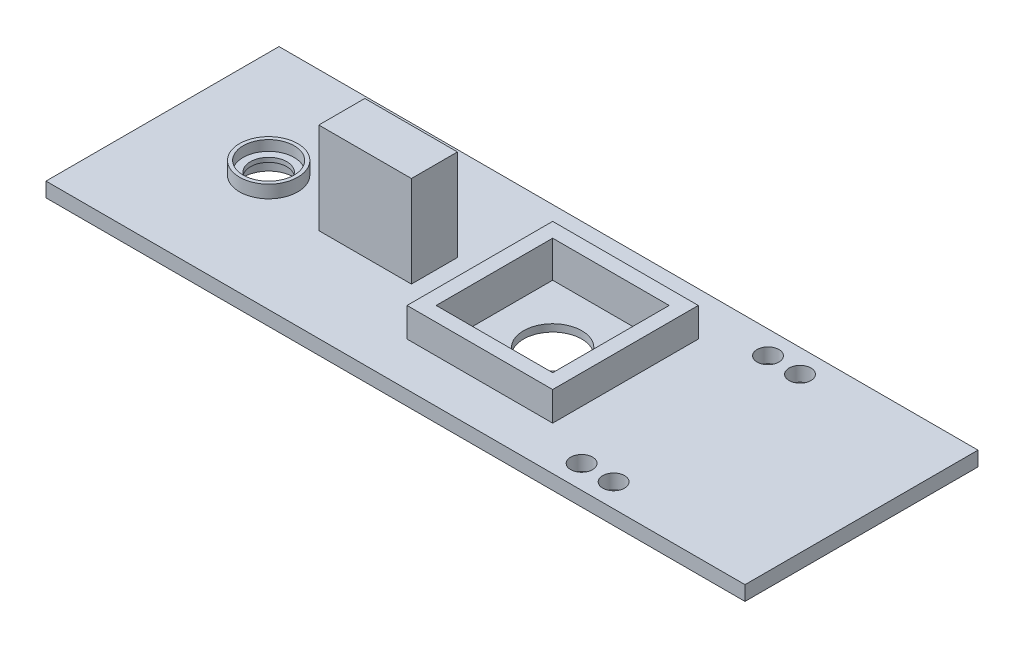
from build123d import *

# Parameters (mm, degrees)
SKETCH1_W           = 304.8
SKETCH1_H           = 101.6
BOSS_EXTRUDE1_DEPTH = 6.35
SKETCH2_R           = 12.7
BOSS_EXTRUDE3_DEPTH = 5.55625
SKETCH9_R           = 11.1125
CUT_EXTRUDE4_DEPTH  = 4.445
CUT_EXTRUDE5_START  = -5.55625
SKETCH10_R          = 11.1125
CUT_EXTRUDE5_DEPTH  = 5.55625
SKETCH11_R          = 7.9375
CUT_EXTRUDE6_DEPTH  = 310.094403462
SKETCH12_R          = 12.7
CUT_EXTRUDE7_DEPTH  = 310.0695755
SKETCH22_W          = 63.5
SKETCH22_H          = 63.5
BOSS_EXTRUDE7_DEPTH = 12.7
SKETCH25_W          = 50.8
SKETCH25_H          = 50.8
CUT_EXTRUDE11_DEPTH = 15.875
SKETCH18_W          = 40.386
SKETCH18_H          = 20.066
BOSS_EXTRUDE5_DEPTH = 39.878
SKETCH32_R          = 4.7625
CUT_EXTRUDE12_DEPTH = 6.35


with BuildPart() as part:
    # Sketch1 → Boss-Extrude1 (new body)
    with BuildSketch(Plane(origin=(0, 0, 0), x_dir=(1, 0, 0), z_dir=(0, 1, 0))):
        with Locations((-152.4, 0)):
            Rectangle(SKETCH1_W, SKETCH1_H)
    extrude(amount=BOSS_EXTRUDE1_DEPTH)

    # Sketch2 → Boss-Extrude3 (add)
    with BuildSketch(Plane(origin=(0, 6.35, 0), x_dir=(1, 0, 0), z_dir=(0, 1, 0))):
        with Locations(Location((-258.510557857, 0, 0), (0, 0, 90))):
            Circle(SKETCH2_R)
    extrude(amount=BOSS_EXTRUDE3_DEPTH)

    # Sketch9 → Cut-Extrude4 (cut)
    with BuildSketch(Plane(origin=(0, 11.90625, 0), x_dir=(1, 0, 0), z_dir=(0, 1, 0))):
        with Locations(Location((-258.510557857, 0, 0), (0, 0, 270))):
            Circle(SKETCH9_R)
    extrude(amount=-CUT_EXTRUDE4_DEPTH, mode=Mode.SUBTRACT)

    # Sketch10 → Cut-Extrude5 (cut)
    with BuildSketch(Plane(origin=(0, 0, 0), x_dir=(-1, 0, 0), z_dir=(0, -1, 0)).offset(CUT_EXTRUDE5_START)):
        with Locations(Location((258.510557857, 0, 0), (0, 0, 270))):
            Circle(SKETCH10_R)
    extrude(amount=CUT_EXTRUDE5_DEPTH, mode=Mode.SUBTRACT)

    # Sketch11 → Cut-Extrude6 (cut, through all)
    with BuildSketch(Plane(origin=(0, 7.46125, 0), x_dir=(1, 0, 0), z_dir=(0, 1, 0))):
        with Locations(Location((-258.510557857, 0, 0), (0, 0, 270))):
            Circle(SKETCH11_R)
    extrude(amount=-CUT_EXTRUDE6_DEPTH, mode=Mode.SUBTRACT)

    # Sketch12 → Cut-Extrude7 (cut, through all)
    with BuildSketch(Plane(origin=(0, 6.35, 0), x_dir=(1, 0, 0), z_dir=(0, 1, 0))):
        with Locations(Location((-134.666203771, 0, 0), (0, 0, 270))):
            Circle(SKETCH12_R)
    extrude(amount=-CUT_EXTRUDE7_DEPTH, mode=Mode.SUBTRACT)

    # Sketch22 → Boss-Extrude7 (add)
    with BuildSketch(Plane(origin=(0, 6.35, 0), x_dir=(1, 0, 0), z_dir=(0, 1, 0))):
        with Locations((-134.666203771, 0)):
            Rectangle(SKETCH22_W, SKETCH22_H)
    extrude(amount=BOSS_EXTRUDE7_DEPTH)

    # Sketch25 → Cut-Extrude11 (cut)
    with BuildSketch(Plane(origin=(0, 19.05, 0), x_dir=(1, 0, 0), z_dir=(0, 1, 0))):
        with Locations((-134.666203771, 0)):
            Rectangle(SKETCH25_W, SKETCH25_H)
    extrude(amount=-CUT_EXTRUDE11_DEPTH, mode=Mode.SUBTRACT)

    # Sketch18 → Boss-Extrude5 (add)
    with BuildSketch(Plane(origin=(0, 6.35, 0), x_dir=(1, 0, 0), z_dir=(0, 1, 0))):
        with Locations((-206.419013169, 0)):
            Rectangle(SKETCH18_W, SKETCH18_H)
    extrude(amount=BOSS_EXTRUDE5_DEPTH)

    # Sketch32 → Cut-Extrude12 (cut)
    with BuildSketch(Plane(origin=(0, 6.35, 0), x_dir=(1, 0, 0), z_dir=(0, 1, 0))):
        with Locations(Location((-67.44195898, -40.64, 0), (0, 0, 270))):
            Circle(SKETCH32_R)
        with Locations(Location((-81.41195898, -40.64, 0), (0, 0, 270))):
            Circle(SKETCH32_R)
        with Locations(Location((-67.44195898, 40.64, 0), (0, 0, 270))):
            Circle(SKETCH32_R)
        with Locations(Location((-81.41195898, 40.64, 0), (0, 0, 270))):
            Circle(SKETCH32_R)
    extrude(amount=-CUT_EXTRUDE12_DEPTH, mode=Mode.SUBTRACT)


solid = part.part
